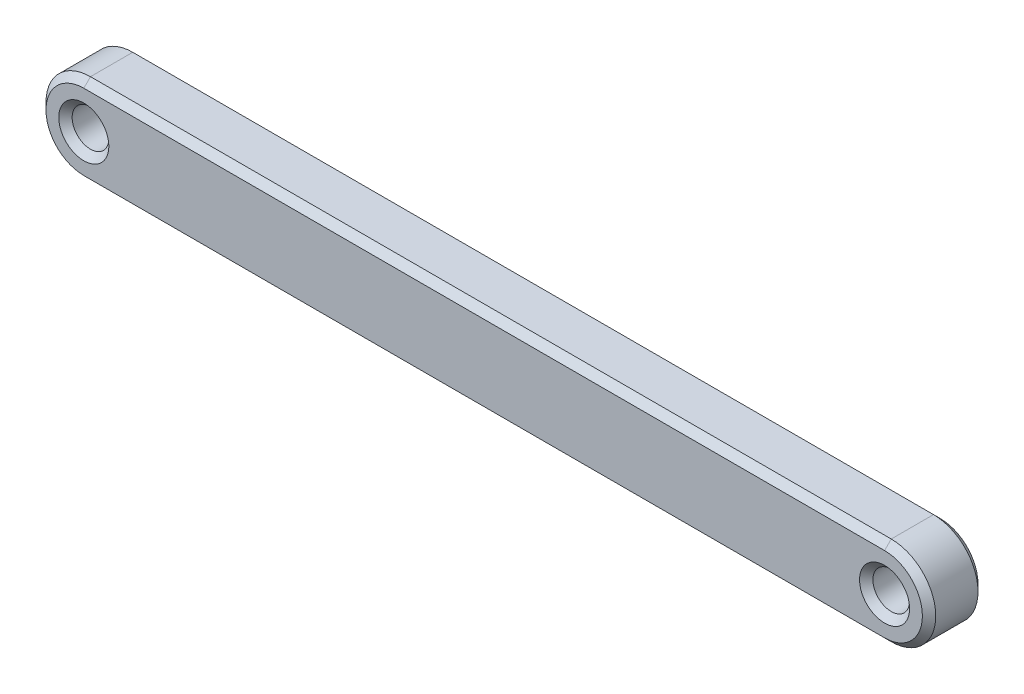
from build123d import *

# Parameters (mm, degrees)
SKETCH_1_R      = 1.65
EXTRUDE_1_DEPTH = 5
CHAMFER_1_SIZE  = 0.6


with BuildPart() as part:
    # 草图1 → 凸台-拉伸1 (new body)
    with BuildSketch(Plane.XY):
        with BuildLine():
            Line((-36, 4), (36, 4))
            ThreePointArc((36, 4), (40, 0), (36, -4))
            Line((36, -4), (-36, -4))
            ThreePointArc((-36, -4), (-40, 0), (-36, 4))
        make_face()
        with Locations((-36, 0)):
            Circle(SKETCH_1_R, mode=Mode.SUBTRACT)
        with Locations((36, 0)):
            Circle(SKETCH_1_R, mode=Mode.SUBTRACT)
    extrude(amount=EXTRUDE_1_DEPTH)

    # 倒角1
    chamfer_1_edges = [part.edges().sort_by_distance(p)[0] for p in [
        (-37.65, 0, 0),
        (-37.65, 0, 5),
        (40, 0, 5),
        (34.35, 0, 0),
        (34.35, 0, 5),
        (0, 4, 5),
        (-40, 0, 5),
        (0, 4, 0),
        (40, 0, 0),
        (0, -4, 0),
        (-40, 0, 0),
        (0, -4, 5),
    ]]
    chamfer(chamfer_1_edges, length=CHAMFER_1_SIZE)


solid = part.part
